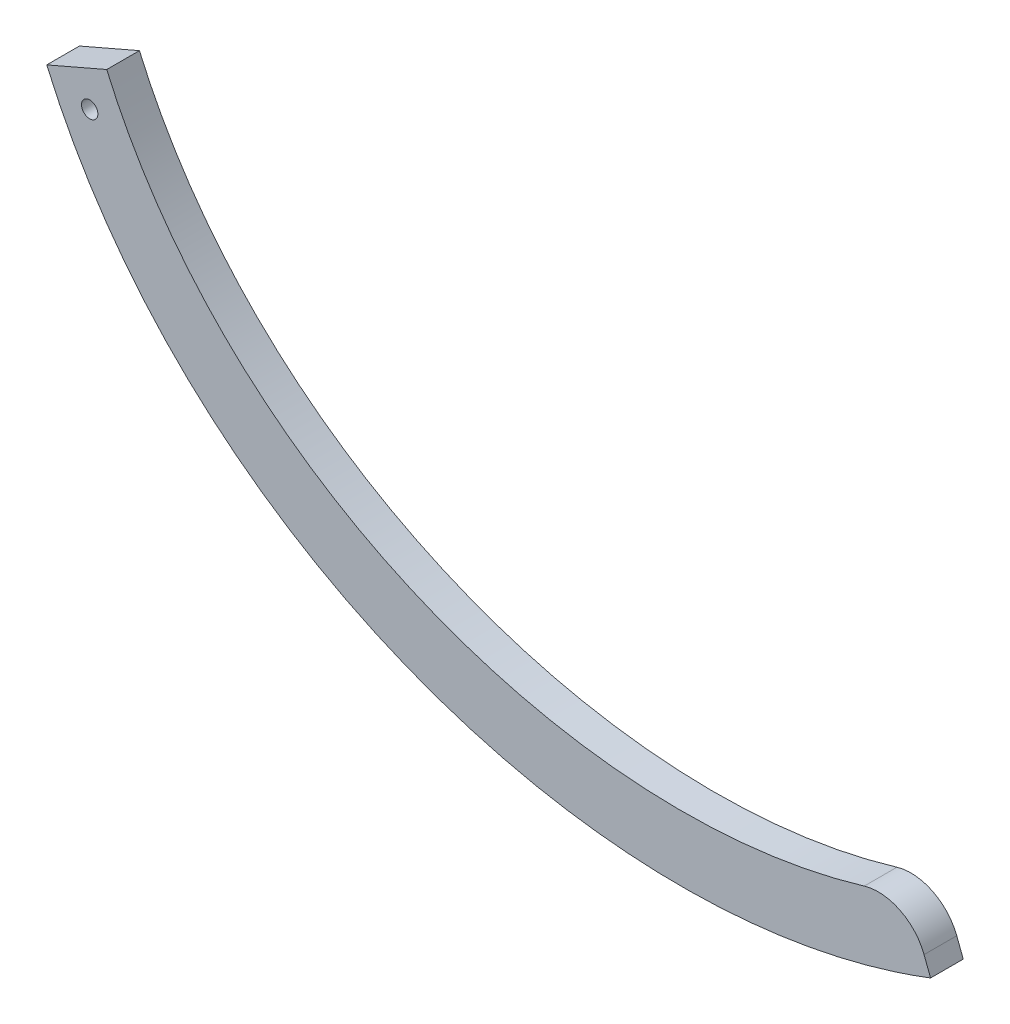
from build123d import *

# Parameters (mm, degrees)
SKETCH1_R           = 2.5
BOSS_EXTRUDE1_DEPTH = 10
FILLET1_R           = 15


with BuildPart() as part:
    # Sketch1 → Boss-Extrude1 (new body)
    with BuildSketch(Plane.XY):
        with BuildLine():
            Line((-153.209844122, 64.22227218), (-134.857466087, 72.171499844))
            add(Edge.make_bspline(
                [(-134.857466087, 72.171499844), (-95.112786079, -19.587023525), (19.679963539, -58.443680936), (109.998130478, -23.821920924)],
                knots=[0, 0, 0, 0, 1, 1, 1, 1], degree=3))
            Line((109.998130478, -23.821920924), (117.156813937, -42.496857366))
            add(Edge.make_bspline(
                [(-153.209844122, 64.22227218), (-151.826469152, 61.02847506), (-148.868667036, 54.694552651), (-142.349662301, 42.556362443), (-133.066091683, 28.258999789), (-120.314236403, 12.602461078), (-106.129642392, -1.524838982), (-90.691829348, -14.090513707), (-68.663135829, -28.734465967), (-38.826934331, -43.036898498), (-0.560107528, -53.64668274), (32.42612627, -56.860637918), (58.90387557, -55.916919646), (78.65907651, -53.410100787), (94.913282093, -49.78386899), (107.704978524, -45.940359032), (114.029028194, -43.695834837), (117.156813937, -42.496857366)],
                knots=[0, 0, 0, 0, 0.03125, 0.0625, 0.125, 0.1875, 0.25, 0.3125, 0.375, 0.5, 0.625, 0.75, 0.8125, 0.875, 0.9375, 0.96875, 1, 1, 1, 1], degree=3))
        make_face()
        with Locations((-140.066359364, 59.017527205)):
            Circle(SKETCH1_R, mode=Mode.SUBTRACT)
    extrude(amount=BOSS_EXTRUDE1_DEPTH)

    # Fillet1
    fillet1_edges = [part.edges().sort_by_distance(p)[0] for p in [
        (109.998130478, -23.821920924, 5),
    ]]
    fillet(fillet1_edges, radius=FILLET1_R)


solid = part.part
